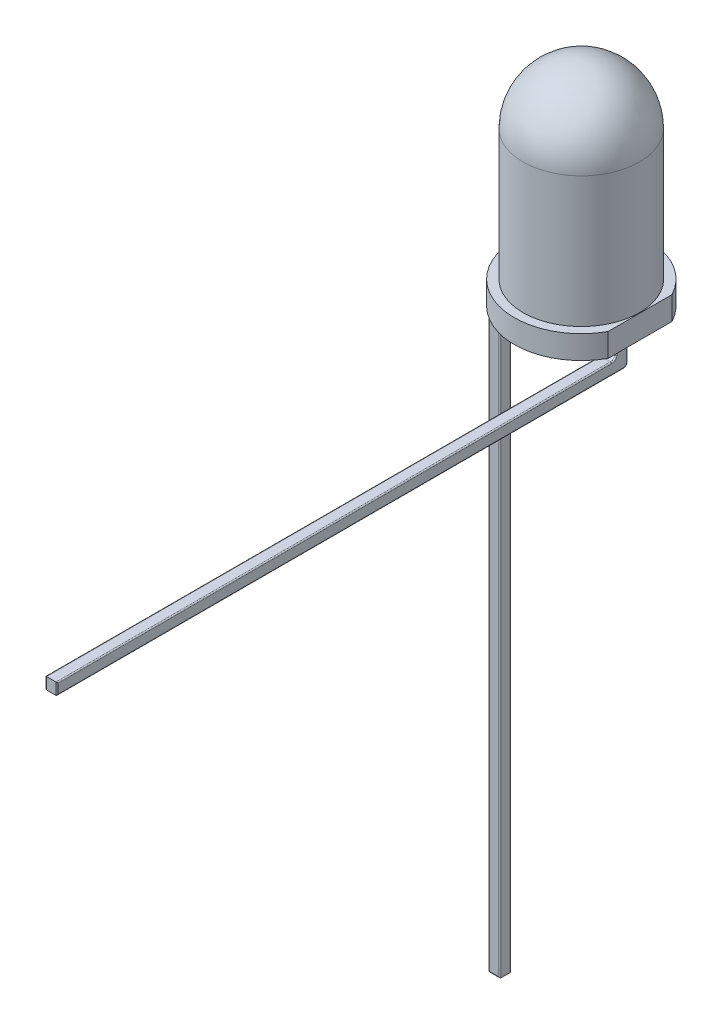
from build123d import *

# Parameters (mm, degrees)
SKETCH1_R           = 2.875
BOSS_EXTRUDE1_DEPTH = 1
SKETCH2_R           = 2.5
BOSS_EXTRUDE2_DEPTH = 5.6
DOME1_FACE_RADIUS   = 2.5
DOME1_HEIGHT        = 2.5
SKETCH3_W           = 1.040189981
SKETCH3_H           = 2.749545416
CUT_EXTRUDE1_DEPTH  = 5.6
SKETCH4_W           = 0.5
SKETCH4_H           = 0.5
BOSS_EXTRUDE3_DEPTH = 1.5
SKETCH5_W           = 0.5
SKETCH5_H           = 0.5
BOSS_EXTRUDE4_DEPTH = 2
SKETCH6_W           = 0.5
SKETCH6_H           = 0.5
BOSS_EXTRUDE5_DEPTH = 25
SKETCH7_W           = 0.5
SKETCH7_H           = 0.5
BOSS_EXTRUDE6_DEPTH = 24
FILLET1_R           = 0.2
FILLET2_R           = 0.05


with BuildPart() as part:
    # Sketch1 → Boss-Extrude1 (new body)
    with BuildSketch(Plane(origin=(0, 0, 0), x_dir=(1, 0, 0), z_dir=(0, 1, 0))):
        with Locations(Location((0, 0, 0), (0, 0, 270))):
            Circle(SKETCH1_R)
    extrude(amount=BOSS_EXTRUDE1_DEPTH)

    # Sketch2 → Boss-Extrude2 (add)
    with BuildSketch(Plane(origin=(0, 1, 0), x_dir=(1, 0, 0), z_dir=(0, 1, 0))):
        with Locations(Location((0, 0, 0), (0, 0, 270))):
            Circle(SKETCH2_R)
    extrude(amount=BOSS_EXTRUDE2_DEPTH)

    # Dome1: a dome of height H over a round flat face of radius A is a cap of a sphere of radius (A * A + H * H) / (2 * H)
    dome1_r = (DOME1_FACE_RADIUS * DOME1_FACE_RADIUS + DOME1_HEIGHT * DOME1_HEIGHT) / (2 * DOME1_HEIGHT)
    dome1_base = Plane((0, 6.6, 0), z_dir=(0, 1, 0))
    with Locations(dome1_base.offset(DOME1_HEIGHT - dome1_r)):
        dome1_ball = Sphere(dome1_r, mode=Mode.PRIVATE)
    add(split(dome1_ball, bisect_by=dome1_base, keep=Keep.TOP, mode=Mode.PRIVATE))

    # Sketch3 → Cut-Extrude1 (cut)
    with BuildSketch(Plane(origin=(0, 1, 0), x_dir=(1, 0, 0), z_dir=(0, 1, 0))):
        with Locations((3.04509499, 0)):
            Rectangle(SKETCH3_W, SKETCH3_H)
    extrude(amount=-CUT_EXTRUDE1_DEPTH, mode=Mode.SUBTRACT)

    # Sketch4 → Boss-Extrude3 (add)
    with BuildSketch(Plane.XZ):
        with Locations((1.5, 0)):
            Rectangle(SKETCH4_W, SKETCH4_H)
        with Locations((-1.5, 0)):
            Rectangle(SKETCH4_W, SKETCH4_H)
    extrude(amount=BOSS_EXTRUDE3_DEPTH)

    # Sketch5 → Boss-Extrude4 (add)
    with BuildSketch(Plane.ZY.offset(1.75)):
        with Locations((0, -1.25)):
            Rectangle(SKETCH5_W, SKETCH5_H)
    extrude(amount=BOSS_EXTRUDE4_DEPTH)

    # Sketch6 → Boss-Extrude5 (add)
    with BuildSketch(Plane.XZ.offset(1.5)):
        with Locations((-3.5, 0)):
            Rectangle(SKETCH6_W, SKETCH6_H)
    extrude(amount=BOSS_EXTRUDE5_DEPTH)

    # Sketch7 → Boss-Extrude6 (add)
    with BuildSketch(Plane.XY.offset(0.25)):
        with Locations((1.5, -1.25)):
            Rectangle(SKETCH7_W, SKETCH7_H)
    extrude(amount=BOSS_EXTRUDE6_DEPTH)

    # Fillet1
    fillet1_edges = [part.edges().sort_by_distance(p)[0] for p in [
        (-3.25, -1.5, 0),
        (-1.75, -1, 0),
        (-3.75, -1, 0),
        (-1.25, -1.5, 0),
        (1.5, -1.5, -0.25),
        (1.5, -1, 0.25),
    ]]
    fillet(fillet1_edges, radius=FILLET1_R)

    # Fillet2
    fillet2_edges = [part.edges().sort_by_distance(p)[0] for p in [
        (-1.75, -0.4, 0.25),
        (-1.75, -0.4, -0.25),
        (-3.75, -13.85, -0.25),
        (-1.25, -0.65, -0.25),
        (-1.308578644, -1.441421356, -0.25),
        (-3.691421356, -1.058578644, -0.25),
        (-1.25, -0.65, 0.25),
        (-1.308578644, -1.441421356, 0.25),
        (-3.691421356, -1.058578644, 0.25),
        (1.25, -0.941421356, 0.308578644),
        (1.75, -0.941421356, 0.308578644),
        (-3.191421356, -1.558578644, 0.25),
        (-3.191421356, -1.558578644, -0.25),
        (-1.808578644, -0.941421356, -0.25),
        (-1.808578644, -0.941421356, 0.25),
        (1.75, 0, 0),
        (1.5, 0, 0.25),
        (1.25, 0, 0),
        (1.5, 0, -0.25),
        (1.25, -1.5, 12.1),
        (-1.25, 0, 0),
        (-1.5, 0, 0.25),
        (-1.75, 0, 0),
        (-1.5, 0, -0.25),
        (-3.75, -13.85, 0.25),
        (-3.25, -14.1, -0.25),
        (-3.25, -14.1, 0.25),
        (-3.5, -26.5, -0.25),
        (-3.5, -26.5, 0.25),
        (1.25, -1, 12.35),
        (1.75, -1, 12.35),
        (1.25, -1.25, 24.25),
        (1.75, -1.25, 24.25),
        (1.75, -1.5, 12.1),
        (1.75, -0.4, 0.25),
        (1.75, -0.65, -0.25),
        (1.75, -1.441421356, -0.191421356),
        (1.25, -0.65, -0.25),
        (1.25, -0.4, 0.25),
        (1.25, -1.441421356, -0.191421356),
        (-2.25, -1.5, -0.25),
        (-2.25, -1.5, 0.25),
        (-2.75, -1, -0.25),
        (-2.75, -1, 0.25),
    ]]
    fillet(fillet2_edges, radius=FILLET2_R)


solid = part.part
